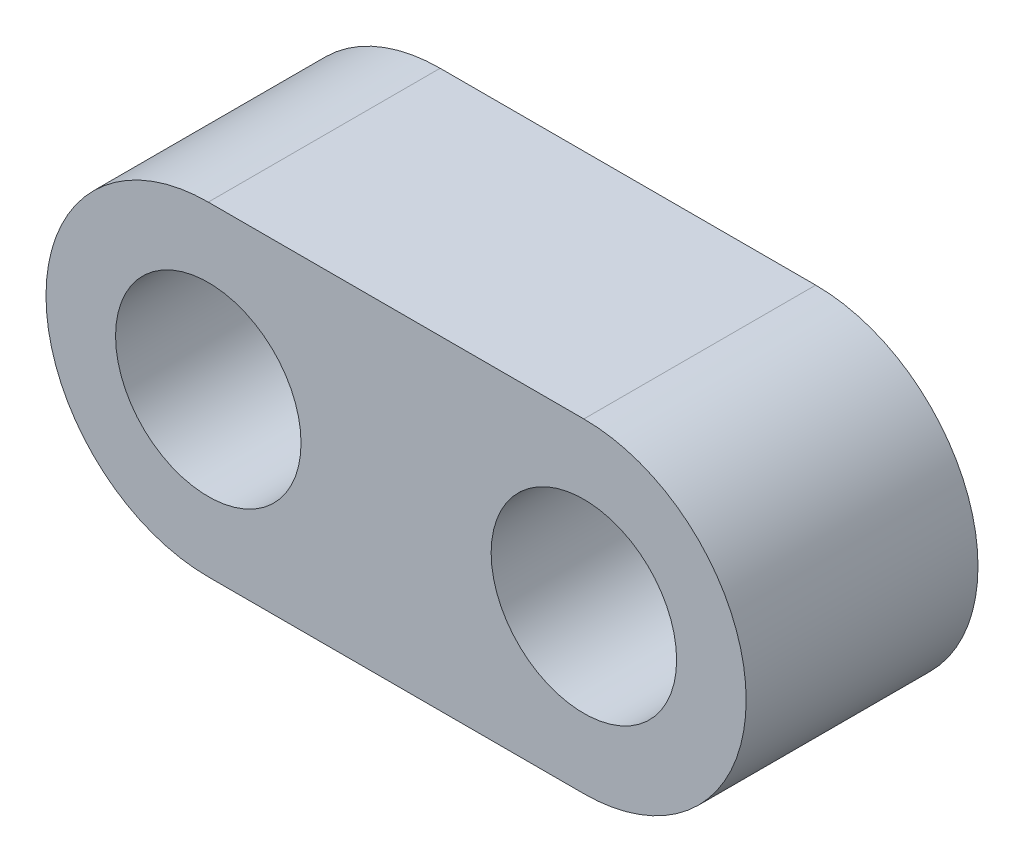
from build123d import *

# Parameters (mm, degrees)
SKETCH_2_R      = 20
EXTRUDE_1_DEPTH = 50


with BuildPart() as part:
    # 草图2 → 凸台-拉伸1 (new body)
    with BuildSketch(Plane.XY):
        with BuildLine():
            Line((0, 35), (81, 35))
            ThreePointArc((81, 35), (116, 0), (81, -35))
            Line((81, -35), (0, -35))
            ThreePointArc((0, -35), (-35, 0), (0, 35))
        make_face()
        Circle(SKETCH_2_R, mode=Mode.SUBTRACT)
        with Locations((81, 0)):
            Circle(SKETCH_2_R, mode=Mode.SUBTRACT)
    extrude(amount=EXTRUDE_1_DEPTH)


solid = part.part
